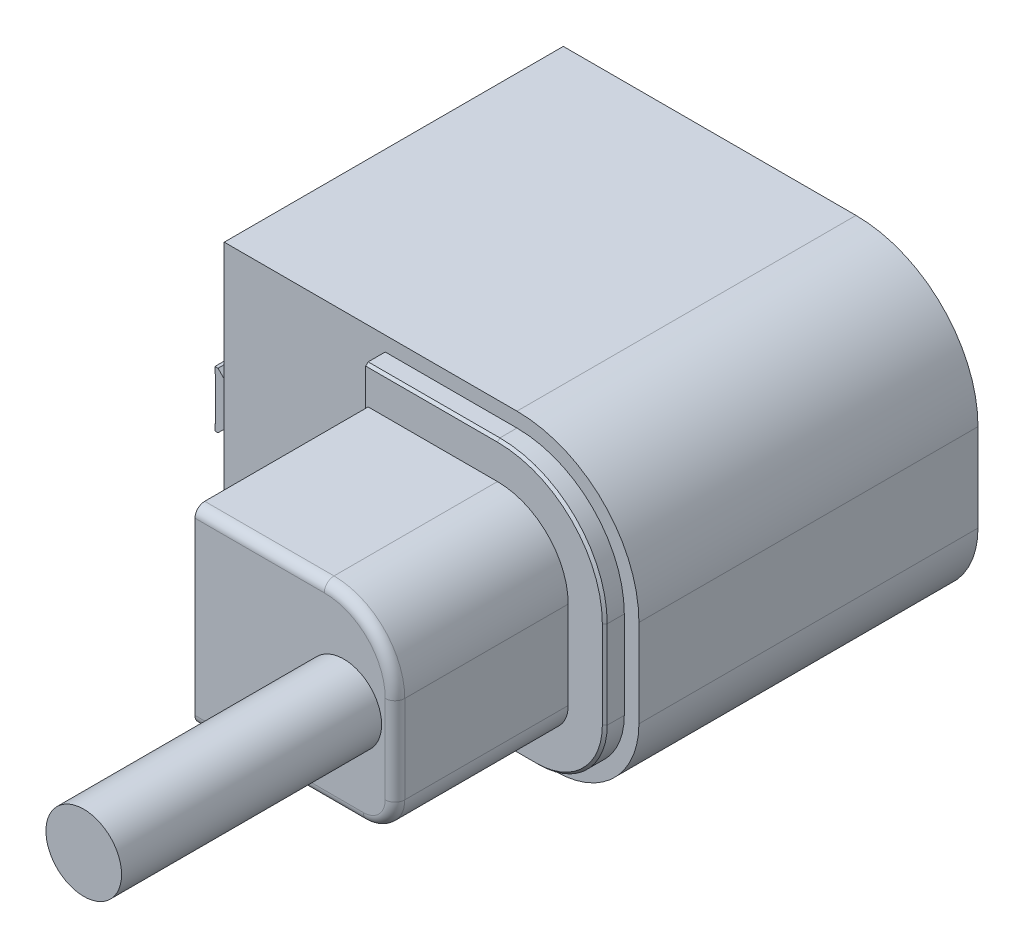
from build123d import *

# Parameters (mm, degrees)
SKETCH1_W           = 85
SKETCH1_H           = 60
BOSS_EXTRUDE1_DEPTH = 69.5
BOSS_EXTRUDE2_DEPTH = 66.05
SKETCH3_W           = 3.16
SKETCH3_H           = 1.25
CUT_EXTRUDE1_DEPTH  = 103.54309143
CUT_EXTRUDE2_DEPTH  = 114.821131606
CUT_EXTRUDE3_DEPTH  = 89.402972801
BOSS_EXTRUDE3_DEPTH = 4
CHAMFER1_SIZE       = 0.5
BOSS_EXTRUDE4_DEPTH = 35.5
SKETCH8_R           = 7.75
BOSS_EXTRUDE5_DEPTH = 53.3
FILLET1_R           = 2
SKETCH9_R           = 2
CUT_EXTRUDE4_DEPTH  = 10


with BuildPart() as part:
    # Sketch1 → Boss-Extrude1 (new body)
    with BuildSketch(Plane.XY):
        Rectangle(SKETCH1_W, SKETCH1_H)
    extrude(amount=BOSS_EXTRUDE1_DEPTH)

    # Sketch2 → Boss-Extrude2 (add)
    with BuildSketch(Plane.XY.offset(69.5)):
        Polygon((-42.5, 3.495), (-42.79, 3.495), (-45.03, 5.73), (-45.66, 5.73), (-45.66, 4.45), (-45.533118158, 4.45), (-45.533118158, -4.45), (-45.66, -4.45), (-45.66, -5.73), (-45.03, -5.73), (-42.79, -3.495), (-42.5, -3.495), align=None)
    extrude(amount=-BOSS_EXTRUDE2_DEPTH)

    # Sketch3 → Cut-Extrude1 (cut, through all)
    with BuildSketch(Plane.XZ.offset(30)):
        with Locations((-44.08, 68.875)):
            Rectangle(SKETCH3_W, SKETCH3_H)
    extrude(amount=-CUT_EXTRUDE1_DEPTH, mode=Mode.SUBTRACT)

    # Sketch4 → Cut-Extrude2 (cut, through all)
    with BuildSketch(Plane.ZY.offset(42.5)):
        Polygon((3.45, 2.7), (14.31, 5.73), (3.45, 5.73), align=None)
        Polygon((3.45, -5.73), (3.45, -2.7), (14.31, -5.73), align=None)
    extrude(amount=CUT_EXTRUDE2_DEPTH, mode=Mode.SUBTRACT)

    # Sketch5 → Cut-Extrude3 (cut, through all)
    with BuildSketch(Plane.XY.offset(69.5)):
        with BuildLine():
            Line((42.5, -13), (42.5, -30))
            Line((42.5, -30), (25.5, -30))
            ThreePointArc((25.5, -30), (37.52081528, -25.02081528), (42.5, -13))
        make_face()
        with BuildLine():
            Line((17.5, 30), (42.5, 30))
            Line((42.5, 30), (42.5, 5))
            ThreePointArc((42.5, 5), (35.17766953, 22.67766953), (17.5, 30))
        make_face()
    extrude(amount=-CUT_EXTRUDE3_DEPTH, mode=Mode.SUBTRACT)

    # Sketch6 → Boss-Extrude3 (add)
    with BuildSketch(Plane.XY.offset(69.5)):
        with BuildLine():
            Line((17.5, 27), (-9.5, 27))
            Line((-9.5, 27), (-9.5, -27))
            Line((-9.5, -27), (17.308513795, -27))
            Line((17.308513795, -27), (25.5, -27))
            ThreePointArc((25.5, -27), (35.399494937, -22.899494937), (39.5, -13))
            Line((39.5, -13), (39.5, 5))
            ThreePointArc((39.5, 5), (33.056349186, 20.556349186), (17.5, 27))
        make_face()
    extrude(amount=BOSS_EXTRUDE3_DEPTH)

    # Chamfer1
    chamfer1_edges = [part.edges().sort_by_distance(p)[0] for p in [
        (33.056349186, 20.556349186, 73.5),
        (4, 27, 73.5),
        (8, -27, 73.5),
        (35.399494937, -22.899494937, 73.5),
        (39.5, -4, 73.5),
    ]]
    chamfer(chamfer1_edges, length=CHAMFER1_SIZE)

    # Sketch7 → Boss-Extrude4 (add)
    with BuildSketch(Plane.XY.offset(73.5)):
        with BuildLine():
            Line((-9, 19.5), (-9, -19.5))
            Line((-9, -19.5), (25.5, -19.5))
            ThreePointArc((25.5, -19.5), (30.096194078, -17.596194078), (32, -13))
            Line((32, -13), (32, 5))
            ThreePointArc((32, 5), (27.753048327, 15.253048327), (17.5, 19.5))
            Line((17.5, 19.5), (-9, 19.5))
        make_face()
    extrude(amount=BOSS_EXTRUDE4_DEPTH)

    # Sketch8 → Boss-Extrude5 (add)
    with BuildSketch(Plane.XY.offset(109)):
        with Locations((21.5, 0)):
            Circle(SKETCH8_R)
    extrude(amount=BOSS_EXTRUDE5_DEPTH)

    # Fillet1
    fillet1_edges = [part.edges().sort_by_distance(p)[0] for p in [
        (4.25, 19.5, 109),
        (8.25, -19.5, 109),
        (30.096194078, -17.596194078, 109),
        (32, -4, 109),
        (27.753048327, 15.253048327, 109),
    ]]
    fillet(fillet1_edges, radius=FILLET1_R)

    # Sketch9 → Cut-Extrude4 (cut)
    with BuildSketch(Plane.ZY.offset(45.533118158)):
        with Locations((55, 0)):
            Circle(SKETCH9_R)
        with Locations((35, 0)):
            Circle(SKETCH9_R)
    extrude(amount=-CUT_EXTRUDE4_DEPTH, mode=Mode.SUBTRACT)


solid = part.part
